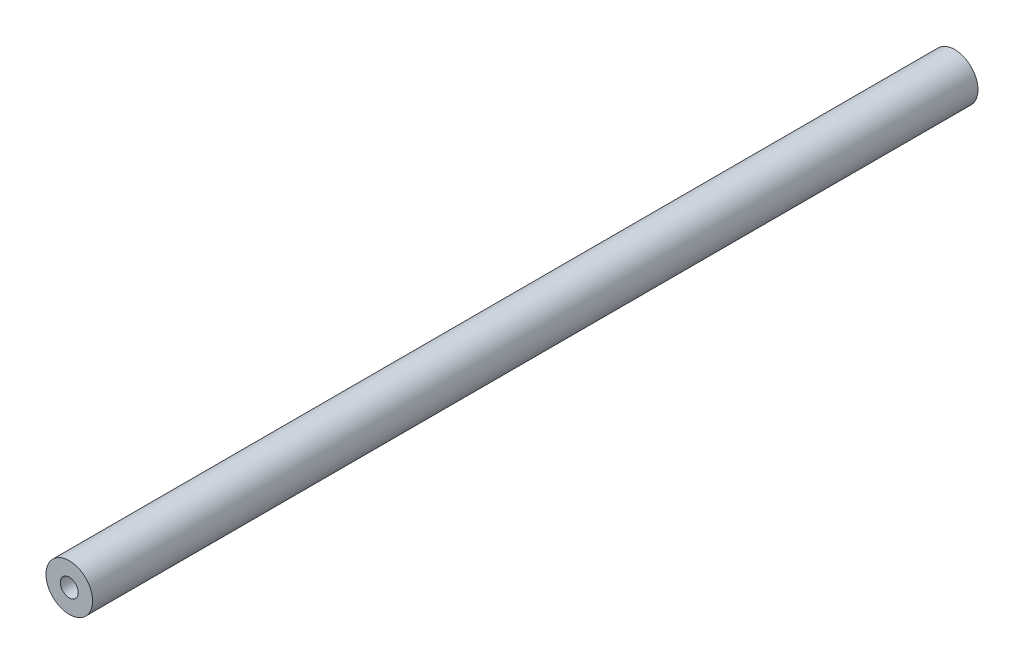
from build123d import *

# Parameters (mm, degrees)
SKETCH1_R           = 3.25
BOSS_EXTRUDE1_DEPTH = 123.5
SKETCH3_R           = 1.25
CUT_EXTRUDE1_DEPTH  = 10
CUT_EXTRUDE2_START  = -10
SKETCH2_R           = 1.25
CUT_EXTRUDE2_DEPTH  = 10


with BuildPart() as part:
    # Sketch1 → Boss-Extrude1 (new body)
    with BuildSketch(Plane.XY):
        Circle(SKETCH1_R)
    extrude(amount=BOSS_EXTRUDE1_DEPTH)

    # Sketch3 → Cut-Extrude1 (cut)
    with BuildSketch(Plane.XY.offset(123.5)):
        Circle(SKETCH3_R)
    extrude(amount=-CUT_EXTRUDE1_DEPTH, mode=Mode.SUBTRACT)

    # Sketch2 → Cut-Extrude2 (cut)
    with BuildSketch(Plane(origin=(0, 0, 0), x_dir=(-1, 0, 0), z_dir=(0, 0, -1)).offset(CUT_EXTRUDE2_START)):
        with Locations(Location((0, 0, 0), (0, 0, 180))):
            Circle(SKETCH2_R)
    extrude(amount=CUT_EXTRUDE2_DEPTH, mode=Mode.SUBTRACT)


solid = part.part
